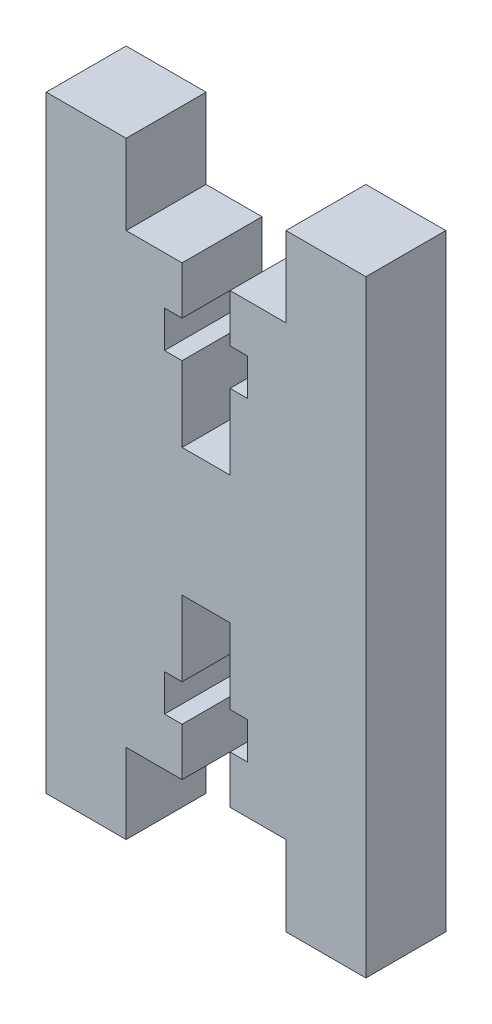
from build123d import *

# Parameters (mm, degrees)
BOSS_EXTRU_1_DEPTH = 5


with BuildPart() as part:
    # Esquisse1 → Boss.-Extru.1 (new body)
    with BuildSketch(Plane.XY):
        Polygon((-1.5, 11), (-2.6, 11), (-2.6, 8.7), (-1.5, 8.7), (-1.5, 4), (1.5, 4), (1.5, 8.7), (2.6, 8.7), (2.6, 11), (1.5, 11), (1.5, 14), (5, 14), (5, 19), (10, 19), (10, 14), (10, -14), (10, -19), (5, -19), (5, -14), (1.5, -14), (1.5, -11), (2.6, -11), (2.6, -8.7), (1.5, -8.7), (1.5, -4), (-1.5, -4), (-1.5, -8.7), (-2.6, -8.7), (-2.6, -11), (-1.5, -11), (-1.5, -14), (-5, -14), (-5, -19), (-10, -19), (-10, -14), (-10, 14), (-10, 19), (-5, 19), (-5, 14), (-1.5, 14), align=None)
    extrude(amount=BOSS_EXTRU_1_DEPTH)


solid = part.part
